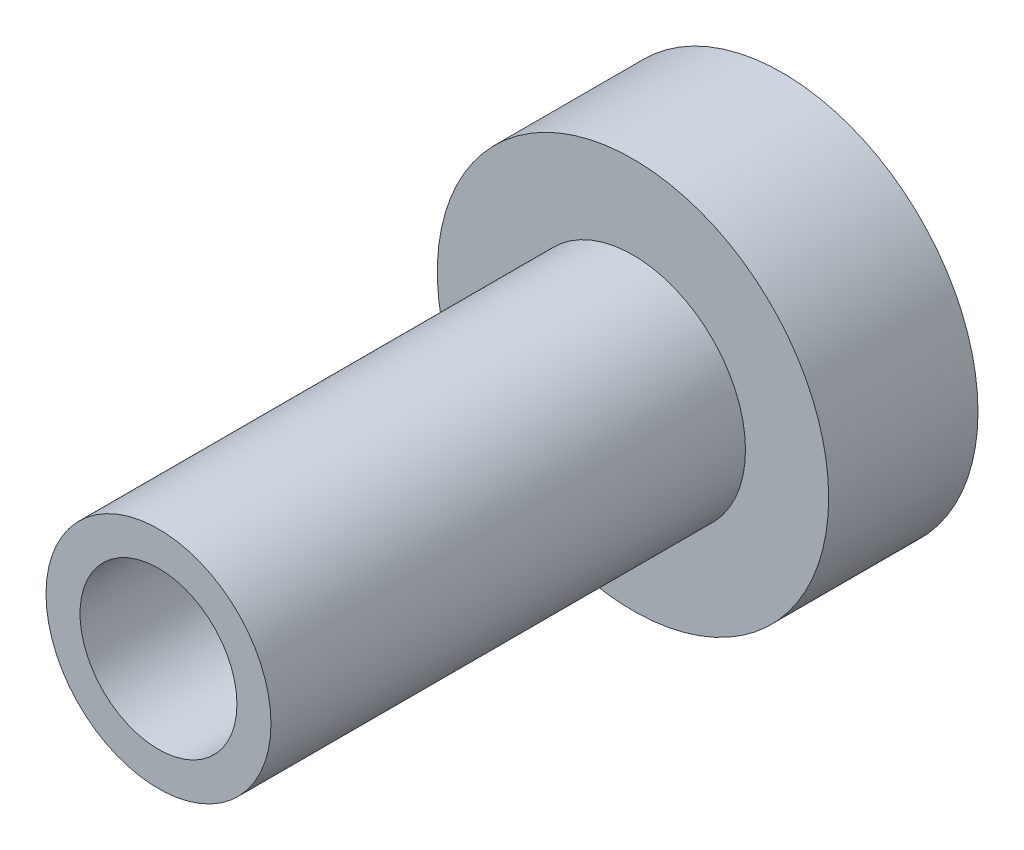
from build123d import *

# Parameters (mm, degrees)
SKETCH1_R           = 10.35
SKETCH1_R_2         = 4.15
BOSS_EXTRUDE1_DEPTH = 33
CUT_EXTRUDE1_START  = -25.1
SKETCH2_R           = 10.35
SKETCH2_R_2         = 5.95
CUT_EXTRUDE1_DEPTH  = 25.1


with BuildPart() as part:
    # Sketch1 → Boss-Extrude1 (new body)
    with BuildSketch(Plane.XY):
        Circle(SKETCH1_R)
        Circle(SKETCH1_R_2, mode=Mode.SUBTRACT)
    extrude(amount=BOSS_EXTRUDE1_DEPTH)

    # Sketch2 → Cut-Extrude1 (cut)
    with BuildSketch(Plane.XY.offset(33).offset(CUT_EXTRUDE1_START)):
        Circle(SKETCH2_R)
        Circle(SKETCH2_R_2, mode=Mode.SUBTRACT)
    extrude(amount=CUT_EXTRUDE1_DEPTH, mode=Mode.SUBTRACT)


solid = part.part
